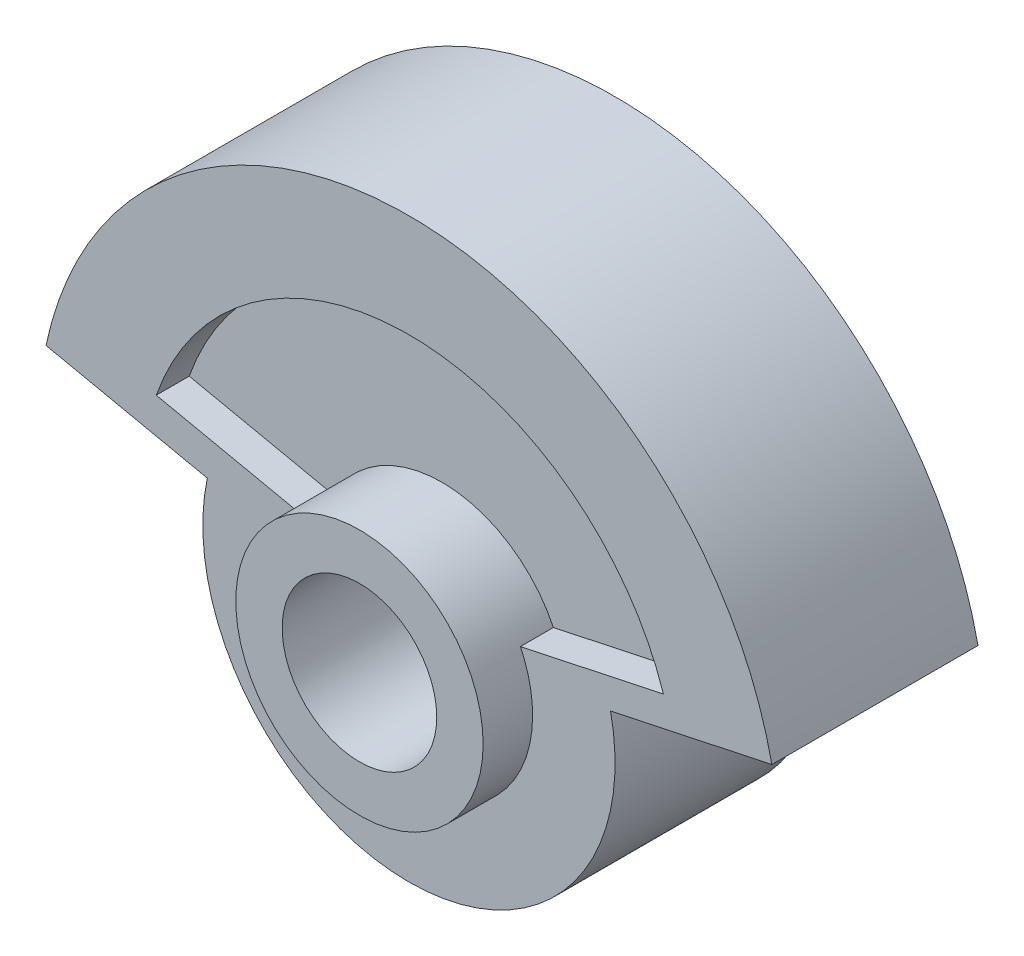
from build123d import *

# Parameters (mm, degrees)
BOSS_EXTRUDE3_DEPTH = 6.2
SKETCH3_2_R         = 1.875
CUT_EXTRUDE2_DEPTH  = 10
CUT_EXTRUDE3_DEPTH  = 2
SKETCH5_R           = 10.344131343
SKETCH5_R_2         = 3
CUT_EXTRUDE4_DEPTH  = 1.2


with BuildPart() as part:
    # Sketch1 → Boss-Extrude3 (new body)
    with BuildSketch(Plane.XY):
        with BuildLine():
            Line((-8.803520999, 1.870298914), (-4.890844999, 1.039054952))
            ThreePointArc((-4.890844999, 1.039054952), (0, -5), (4.890844999, 1.039054952))
            Line((4.890844999, 1.039054952), (8.803520999, 1.870298914))
            ThreePointArc((8.803520999, 1.870298914), (0, 9), (-8.803520999, 1.870298914))
        make_face()
    extrude(amount=BOSS_EXTRUDE3_DEPTH)

    # Sketch3<2> → Cut-Extrude2 (cut)
    with BuildSketch(Plane.XY.offset(6.2)):
        Circle(SKETCH3_2_R)
    extrude(amount=-CUT_EXTRUDE2_DEPTH, mode=Mode.SUBTRACT)

    # Sketch4 → Cut-Extrude3 (cut)
    with BuildSketch(Plane.XY.offset(6.2)):
        with BuildLine():
            Line((2.704066688, 1.299239525), (6.172842293, 2.036177308))
            ThreePointArc((6.172842293, 2.036177308), (0.066834303, 6.499656389), (-6.129666509, 2.162680856))
            Line((-6.129666509, 2.162680856), (-2.641748736, 1.42167634))
            ThreePointArc((-2.641748736, 1.42167634), (0.068691886, 2.999213468), (2.704066688, 1.299239525))
        make_face()
    extrude(amount=-CUT_EXTRUDE3_DEPTH, mode=Mode.SUBTRACT)

    # Sketch5 → Cut-Extrude4 (cut)
    with BuildSketch(Plane.XY.offset(6.2)):
        Circle(SKETCH5_R)
        Circle(SKETCH5_R_2, mode=Mode.SUBTRACT)
    extrude(amount=-CUT_EXTRUDE4_DEPTH, mode=Mode.SUBTRACT)


solid = part.part
